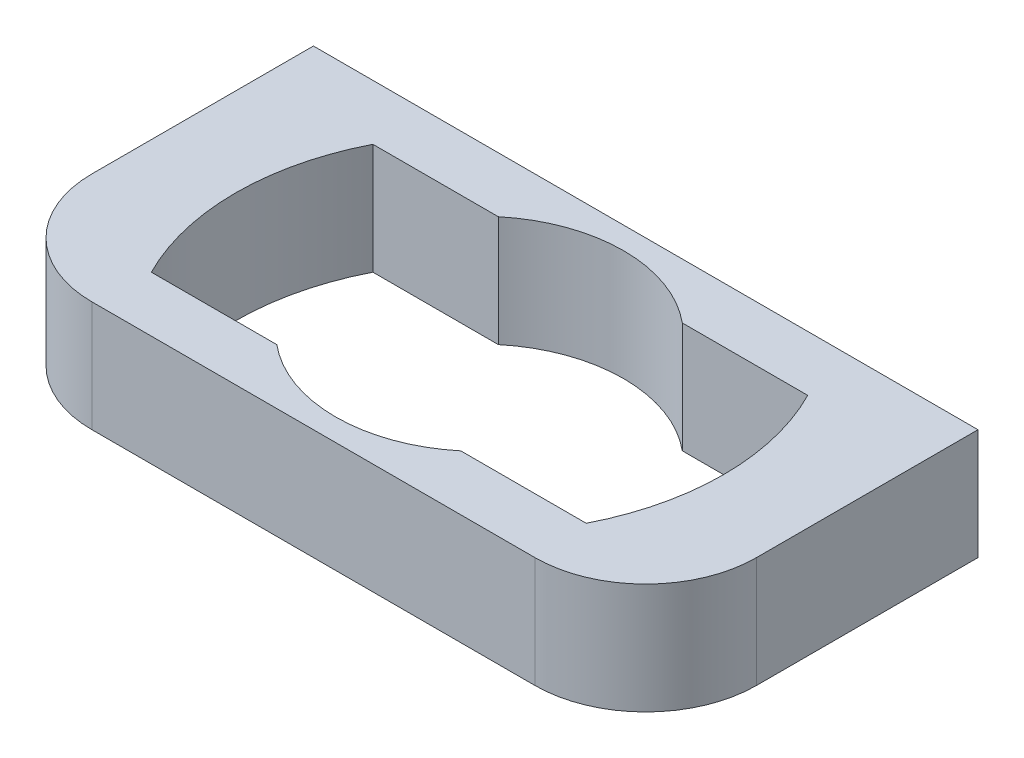
from build123d import *

# Parameters (mm, degrees)
SKETCH_1_W          = 60
SKETCH_1_H          = 30
EXTRUDE_1_DEPTH     = 10
FILLET_1_R          = 10
SKETCH_2_R          = 2.4
CUT_EXTRUDE_1_DEPTH = 6


with BuildPart() as part:
    # ｽｹｯﾁ1 → ﾎﾞｽ - 押し出し1 (new body)
    with BuildSketch(Plane(origin=(0, 0, 0), x_dir=(1, 0, 0), z_dir=(0, 1, 0))):
        Rectangle(SKETCH_1_W, SKETCH_1_H)
        with BuildLine():
            Line((19.629592456, -10), (8.306623863, -10))
            ThreePointArc((8.306623863, -10), (0, -13), (-8.306623863, -10))
            Line((-8.306623863, -10), (-19.629592456, -10))
            ThreePointArc((-19.629592456, -10), (-22.03, 0), (-19.629592456, 10))
            Line((-19.629592456, 10), (-8.306623863, 10))
            ThreePointArc((-8.306623863, 10), (0, 13), (8.306623863, 10))
            Line((8.306623863, 10), (19.629592456, 10))
            ThreePointArc((19.629592456, 10), (22.03, 0), (19.629592456, -10))
        make_face(mode=Mode.SUBTRACT)
    extrude(amount=EXTRUDE_1_DEPTH)

    # ﾌｨﾚｯﾄ1
    fillet_1_edges = [part.edges().sort_by_distance(p)[0] for p in [
        (30, 5, 15),
        (-30, 5, 15),
    ]]
    fillet(fillet_1_edges, radius=FILLET_1_R)

    # ｽｹｯﾁ2 → ｶｯﾄ - 押し出し1 (cut)
    with BuildSketch(Plane(origin=(0, 0, -15), x_dir=(-1, 0, 0), z_dir=(0, 0, -1))):
        with Locations((25, 5)):
            Circle(SKETCH_2_R)
        with Locations((-25, 5)):
            Circle(SKETCH_2_R)
    extrude(amount=-CUT_EXTRUDE_1_DEPTH, mode=Mode.SUBTRACT)


solid = part.part
